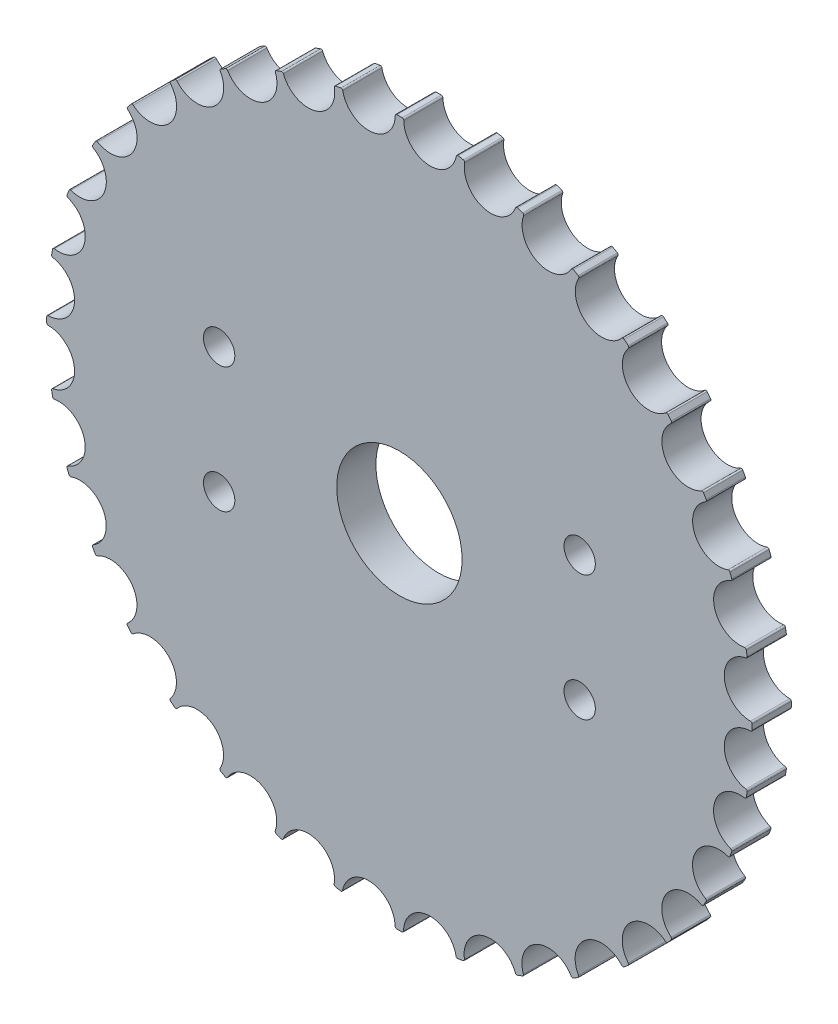
from build123d import *

# Parameters (mm, degrees)
SKETCH_1_R          = 45
EXTRUDE_1_DEPTH     = 5
SKETCH_2_R          = 3.38
CUT_EXTRUDE_2_DEPTH = 50
FILLET_1_R          = 0.2
SKETCH_4_R          = 8
CUT_EXTRUDE_3_DEPTH = 10
SKETCH_5_R          = 2
CUT_EXTRUDE_4_DEPTH = 10


with BuildPart() as part:
    # 스케치1 → 보스-돌출1 (new body)
    with BuildSketch(Plane.XY):
        Circle(SKETCH_1_R)
    extrude(amount=EXTRUDE_1_DEPTH)

    # 스케치2 → 컷-돌출2 (cut)
    with BuildSketch(Plane.XY.offset(5)):
        with Locations((3.93571055, 44.827560523)):
            Circle(SKETCH_2_R)
        with Locations((11.660142457, 43.463100187)):
            Circle(SKETCH_2_R)
        with Locations((19.030286837, 40.778035545)):
            Circle(SKETCH_2_R)
        with Locations((25.82220558, 36.853950928)):
            Circle(SKETCH_2_R)
        with Locations((31.829529673, 31.81007766)):
            Circle(SKETCH_2_R)
        with Locations((36.869729614, 25.79967128)):
            Circle(SKETCH_2_R)
        with Locations((40.789661478, 19.005354943)):
            Circle(SKETCH_2_R)
        with Locations((43.470220118, 11.633570514)):
            Circle(SKETCH_2_R)
        with Locations((44.829958117, 3.908305931)):
            Circle(SKETCH_2_R)
        with Locations((44.827560523, -3.93571055)):
            Circle(SKETCH_2_R)
        with Locations((43.463100187, -11.660142457)):
            Circle(SKETCH_2_R)
        with Locations((40.778035545, -19.030286837)):
            Circle(SKETCH_2_R)
        with Locations((36.853950928, -25.82220558)):
            Circle(SKETCH_2_R)
        with Locations((31.81007766, -31.829529673)):
            Circle(SKETCH_2_R)
        with Locations((25.79967128, -36.869729614)):
            Circle(SKETCH_2_R)
        with Locations((19.005354943, -40.789661478)):
            Circle(SKETCH_2_R)
        with Locations((11.633570514, -43.470220118)):
            Circle(SKETCH_2_R)
        with Locations((3.908305931, -44.829958117)):
            Circle(SKETCH_2_R)
        with Locations((-3.93571055, -44.827560523)):
            Circle(SKETCH_2_R)
        with Locations((-11.660142457, -43.463100187)):
            Circle(SKETCH_2_R)
        with Locations((-19.030286837, -40.778035545)):
            Circle(SKETCH_2_R)
        with Locations((-25.82220558, -36.853950928)):
            Circle(SKETCH_2_R)
        with Locations((-31.829529673, -31.81007766)):
            Circle(SKETCH_2_R)
        with Locations((-36.869729614, -25.79967128)):
            Circle(SKETCH_2_R)
        with Locations((-40.789661478, -19.005354943)):
            Circle(SKETCH_2_R)
        with Locations((-43.470220118, -11.633570514)):
            Circle(SKETCH_2_R)
        with Locations((-44.829958117, -3.908305931)):
            Circle(SKETCH_2_R)
        with Locations((-44.827560523, 3.93571055)):
            Circle(SKETCH_2_R)
        with Locations((-43.463100187, 11.660142457)):
            Circle(SKETCH_2_R)
        with Locations((-40.778035545, 19.030286837)):
            Circle(SKETCH_2_R)
        with Locations((-36.853950928, 25.82220558)):
            Circle(SKETCH_2_R)
        with Locations((-31.81007766, 31.829529673)):
            Circle(SKETCH_2_R)
        with Locations((-25.79967128, 36.869729614)):
            Circle(SKETCH_2_R)
        with Locations((-19.005354943, 40.789661478)):
            Circle(SKETCH_2_R)
        with Locations((-11.633570514, 43.470220118)):
            Circle(SKETCH_2_R)
        with Locations((-3.908305931, 44.829958117)):
            Circle(SKETCH_2_R)
    extrude(amount=-CUT_EXTRUDE_2_DEPTH, mode=Mode.SUBTRACT)

    # 필렛1
    fillet_1_edges = [part.edges().sort_by_distance(p)[0] for p in [
        (44.996850108, 0.532428702, 2.5),
        (44.410149891, 7.262133752, 2.5),
        (44.220791574, 8.337960936, 2.5),
        (42.474403633, 14.863547221, 2.5),
        (42.101106664, 15.890148446, 2.5),
        (39.248094114, 22.013339329, 2.5),
        (38.702200933, 22.959521836, 2.5),
        (34.829251116, 28.49426726, 2.5),
        (28.515553676, 34.811825556, 2.5),
        (22.983176889, 38.688158138, 2.5),
        (34.127348411, 29.331281773, 2.5),
        (29.352138947, 34.1094113, 2.5),
        (22.037328273, 39.234629635, 2.5),
        (15.915882631, 42.091384868, 2.5),
        (14.889509801, 42.465309346, 2.5),
        (8.364992333, 44.215686168, 2.5),
        (8.337960936, -44.220791574, 2.5),
        (14.863547221, -42.474403633, 2.5),
        (15.890148446, -42.101106664, 2.5),
        (22.013339329, -39.248094114, 2.5),
        (29.331281773, -34.127348411, 2.5),
        (34.1094113, -29.352138947, 2.5),
        (22.959521836, -38.702200933, 2.5),
        (28.49426726, -34.829251116, 2.5),
        (34.811825556, -28.515553676, 2.5),
        (38.688158138, -22.983176889, 2.5),
        (39.234629635, -22.037328273, 2.5),
        (42.091384868, -15.915882631, 2.5),
        (42.465309346, -14.889509801, 2.5),
        (44.215686168, -8.364992333, 2.5),
        (44.405702122, -7.289281108, 2.5),
        (44.996516217, -0.559935976, 2.5),
        (0.532428702, -44.996850108, 2.5),
        (7.262133752, -44.410149891, 2.5),
        (-7.289281108, -44.405702122, 2.5),
        (-0.559935976, -44.996516217, 2.5),
        (-14.889509801, -42.465309346, 2.5),
        (-8.364992333, -44.215686168, 2.5),
        (-22.037328273, -39.234629635, 2.5),
        (-15.915882631, -42.091384868, 2.5),
        (-42.101106664, -15.890148446, 2.5),
        (-39.248094114, -22.013339329, 2.5),
        (-38.702200933, -22.959521836, 2.5),
        (-34.829251116, -28.49426726, 2.5),
        (-28.515553676, -34.811825556, 2.5),
        (-22.983176889, -38.688158138, 2.5),
        (-34.127348411, -29.331281773, 2.5),
        (-29.352138947, -34.1094113, 2.5),
        (-44.220791574, -8.337960936, 2.5),
        (-42.474403633, -14.863547221, 2.5),
        (-44.996850108, -0.532428702, 2.5),
        (-44.410149891, -7.262133752, 2.5),
        (-44.405702122, 7.289281108, 2.5),
        (-44.996516217, 0.559935976, 2.5),
        (-42.465309346, 14.889509801, 2.5),
        (-44.215686168, 8.364992333, 2.5),
        (-29.331281773, 34.127348411, 2.5),
        (-34.1094113, 29.352138947, 2.5),
        (-22.959521836, 38.702200933, 2.5),
        (-28.49426726, 34.829251116, 2.5),
        (-34.811825556, 28.515553676, 2.5),
        (-38.688158138, 22.983176889, 2.5),
        (-39.234629635, 22.037328273, 2.5),
        (-42.091384868, 15.915882631, 2.5),
        (-15.890148446, 42.101106664, 2.5),
        (-22.013339329, 39.248094114, 2.5),
        (-8.337960936, 44.220791574, 2.5),
        (-14.863547221, 42.474403633, 2.5),
        (-0.532428702, 44.996850108, 2.5),
        (-7.262133752, 44.410149891, 2.5),
        (7.289281108, 44.405702122, 2.5),
        (0.559935976, 44.996516217, 2.5),
    ]]
    fillet(fillet_1_edges, radius=FILLET_1_R)

    # 스케치4 → 컷-돌출3 (cut)
    with BuildSketch(Plane.XY.offset(5)):
        Circle(SKETCH_4_R)
    extrude(amount=-CUT_EXTRUDE_3_DEPTH, mode=Mode.SUBTRACT)

    # 스케치5 → 컷-돌출4 (cut)
    with BuildSketch(Plane.XY.offset(5)):
        with Locations((-23, 8)):
            Circle(SKETCH_5_R)
        with Locations((23, 8)):
            Circle(SKETCH_5_R)
        with Locations((23, -8)):
            Circle(SKETCH_5_R)
        with Locations((-23, -8)):
            Circle(SKETCH_5_R)
    extrude(amount=-CUT_EXTRUDE_4_DEPTH, mode=Mode.SUBTRACT)


solid = part.part
